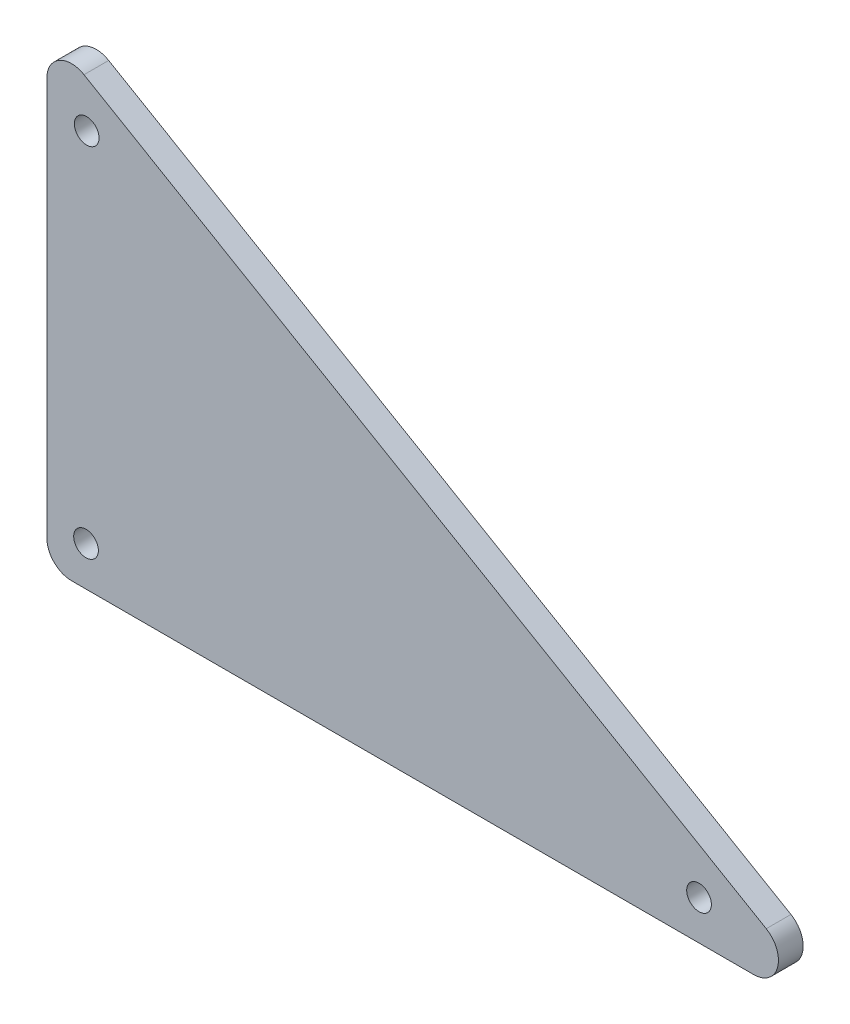
from build123d import *

# Parameters (mm, degrees)
ESBO_O1_R                = 2.5
RESSALTO_EXTRUS_O1_DEPTH = 5
FILETE1_R                = 5


with BuildPart() as part:
    # Esboço1 → Ressalto-extrusão1 (new body)
    with BuildSketch(Plane.XY):
        Polygon((80.424614017, -51.973967516), (-81.208731643, -51.973967516), (-81.208731643, 42.432853022), align=None)
        with Locations((-73.142213803, 28.456719531)):
            Circle(ESBO_O1_R, mode=Mode.SUBTRACT)
        with Locations((50.864750517, -43.973280469)):
            Circle(ESBO_O1_R, mode=Mode.SUBTRACT)
        with Locations((-73.275249483, -43.973280469)):
            Circle(ESBO_O1_R, mode=Mode.SUBTRACT)
    extrude(amount=RESSALTO_EXTRUS_O1_DEPTH)

    # Filete1
    filete1_edges = [part.edges().sort_by_distance(p)[0] for p in [
        (-81.208731643, 42.432853022, 2.5),
        (80.424614017, -51.973967516, 2.5),
        (-81.208731643, -51.973967516, 2.5),
    ]]
    fillet(filete1_edges, radius=FILETE1_R)


solid = part.part
